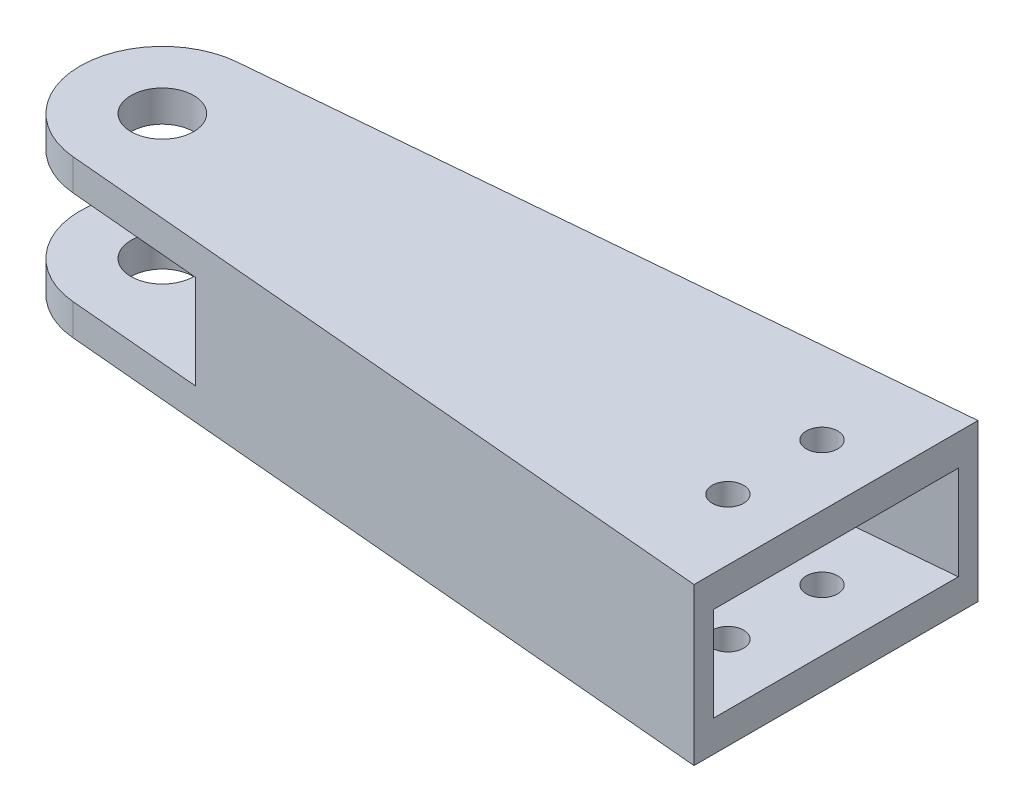
from build123d import *

# Parameters (mm, degrees)
SKETCH1_R           = 4
BOSS_EXTRUDE1_DEPTH = 4
SKETCH2_R           = 4
BOSS_EXTRUDE2_DEPTH = 4
BOSS_EXTRUDE5_DEPTH = 12
SKETCH6_R           = 2
CUT_EXTRUDE1_DEPTH  = 174.51019967
BOSS_EXTRUDE6_DEPTH = 12


with BuildPart() as part:
    # Sketch1 → Boss-Extrude1 (new body)
    with BuildSketch(Plane(origin=(0, 0, 0), x_dir=(1, 0, 0), z_dir=(0, 1, 0))):
        with BuildLine():
            Line((-75, 18.10605947), (-161.821193893, 10.459512504))
            ThreePointArc((-161.821193893, 10.459512504), (-171.4, 0), (-161.821193893, -10.459512504))
            Line((-161.821193893, -10.459512504), (-75, -18.10605947))
            Line((-75, -18.10605947), (-75, 18.10605947))
        make_face()
        with Locations(Location((-160.9, 0, 0), (0, 0, 270))):
            Circle(SKETCH1_R, mode=Mode.SUBTRACT)
    extrude(amount=BOSS_EXTRUDE1_DEPTH)



with BuildPart() as body_2:
    # Sketch2 → Boss-Extrude2 (new body)
    with BuildSketch(Plane(origin=(0, 16, 0), x_dir=(1, 0, 0), z_dir=(0, 1, 0))):
        with BuildLine():
            Line((-75, 18.10605947), (-161.821193893, 10.459512504))
            ThreePointArc((-161.821193893, 10.459512504), (-171.4, 0), (-161.821193893, -10.459512504))
            Line((-161.821193893, -10.459512504), (-75, -18.10605947))
            Line((-75, -18.10605947), (-75, 18.10605947))
        make_face()
        with Locations(Location((-160.9, 0, 0), (0, 0, 270))):
            Circle(SKETCH2_R, mode=Mode.SUBTRACT)
    extrude(amount=BOSS_EXTRUDE2_DEPTH)


with BuildPart() as part_1:
    add(part.part)

    add(body_2.part)  # Boss-Extrude5 merges body 2
    # Sketch5 → Boss-Extrude5 (add)
    with BuildSketch(Plane(origin=(0, 4, 0), x_dir=(1, 0, 0), z_dir=(0, 1, 0))):
        Polygon((-75, -18.10605947), (-75, -15.596382275), (-144.510751478, -9.47440673), (-144.730083357, -11.964766849), align=None)
        Polygon((-75, 15.596382275), (-75, 18.10605947), (-144.730083357, 11.964766849), (-144.510751478, 9.47440673), align=None)
    extrude(amount=BOSS_EXTRUDE5_DEPTH)

    # Sketch6 → Cut-Extrude1 (cut, through all)
    with BuildSketch(Plane(origin=(0, 0, 0), x_dir=(-1, 0, 0), z_dir=(0, -1, 0))):
        with Locations(Location((82.8, -5.982385529, 0), (0, 0, 90))):
            Circle(SKETCH6_R)
        with Locations(Location((82.8, 6.017614471, 0), (0, 0, 90))):
            Circle(SKETCH6_R)
    extrude(amount=-CUT_EXTRUDE1_DEPTH, mode=Mode.SUBTRACT)

    # Sketch7 → Boss-Extrude6 (add)
    with BuildSketch(Plane(origin=(0, 4, 0), x_dir=(1, 0, 0), z_dir=(0, 1, 0))):
        Polygon((-144.510751478, 9.47440673), (-144.510751478, -9.47440673), (-95, -13.834935185), (-95, 13.834935185), align=None)
    extrude(amount=BOSS_EXTRUDE6_DEPTH)


solid = part_1.part
